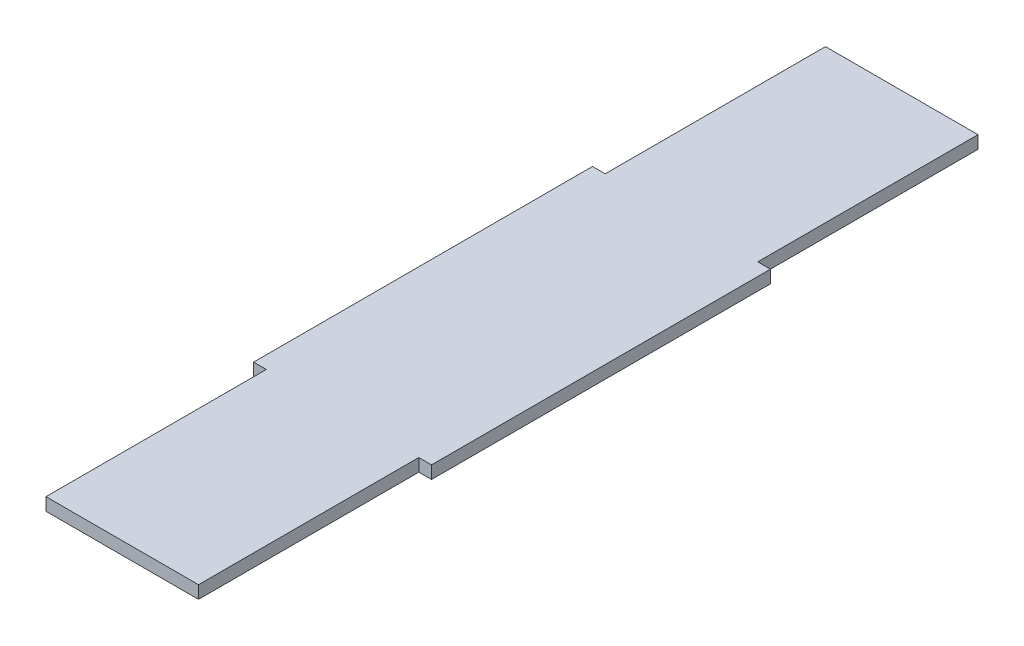
from build123d import *

# Parameters (mm, degrees)
SKETCH1_W           = 3
SKETCH1_H           = 80
BOSS_EXTRUDE1_DEPTH = 3


with BuildPart() as part:
    # Sketch1 → Boss-Extrude1 (new body)
    with BuildSketch(Plane(origin=(0, 0, 0), x_dir=(1, 0, 0), z_dir=(0, 1, 0))):
        Polygon((-18, -40), (-18, -92), (18, -92), (18, -40), (15, -40), (15, 40), (18, 40), (18, 92), (-18, 92), (-18, 40), (-15, 40), (-15, -40), align=None)
        with Locations((16.5, 0)):
            Rectangle(SKETCH1_W, SKETCH1_H)
        with Locations((19.5, 0)):
            Rectangle(SKETCH1_W, SKETCH1_H)
        with Locations((-19.5, 0)):
            Rectangle(SKETCH1_W, SKETCH1_H)
        with Locations((-16.5, 0)):
            Rectangle(SKETCH1_W, SKETCH1_H)
    extrude(amount=BOSS_EXTRUDE1_DEPTH)


solid = part.part
